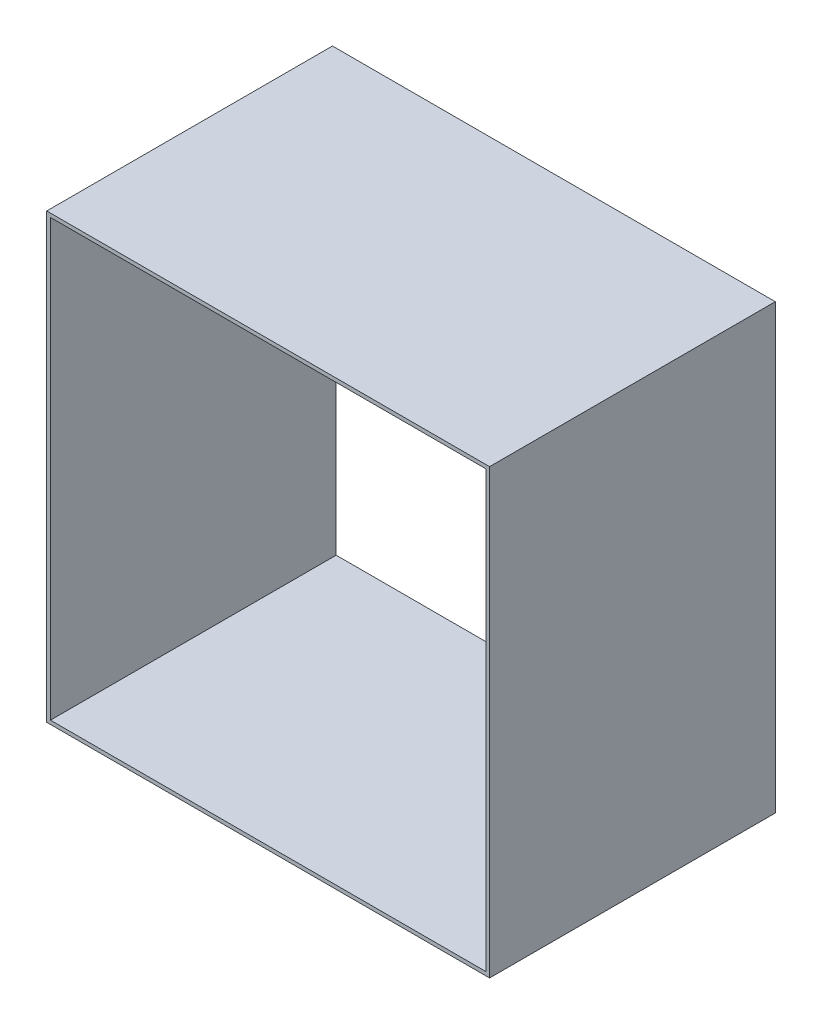
from build123d import *

# Parameters (mm, degrees)
SKETCH1_W           = 651
SKETCH1_H           = 651
SKETCH1_W_2         = 640
SKETCH1_H_2         = 640
BOSS_EXTRUDE1_DEPTH = 420


with BuildPart() as part:
    # Sketch1 → Boss-Extrude1 (new body)
    with BuildSketch(Plane.XY):
        Rectangle(SKETCH1_W, SKETCH1_H)
        Rectangle(SKETCH1_W_2, SKETCH1_H_2, mode=Mode.SUBTRACT)
    extrude(amount=BOSS_EXTRUDE1_DEPTH)


solid = part.part
